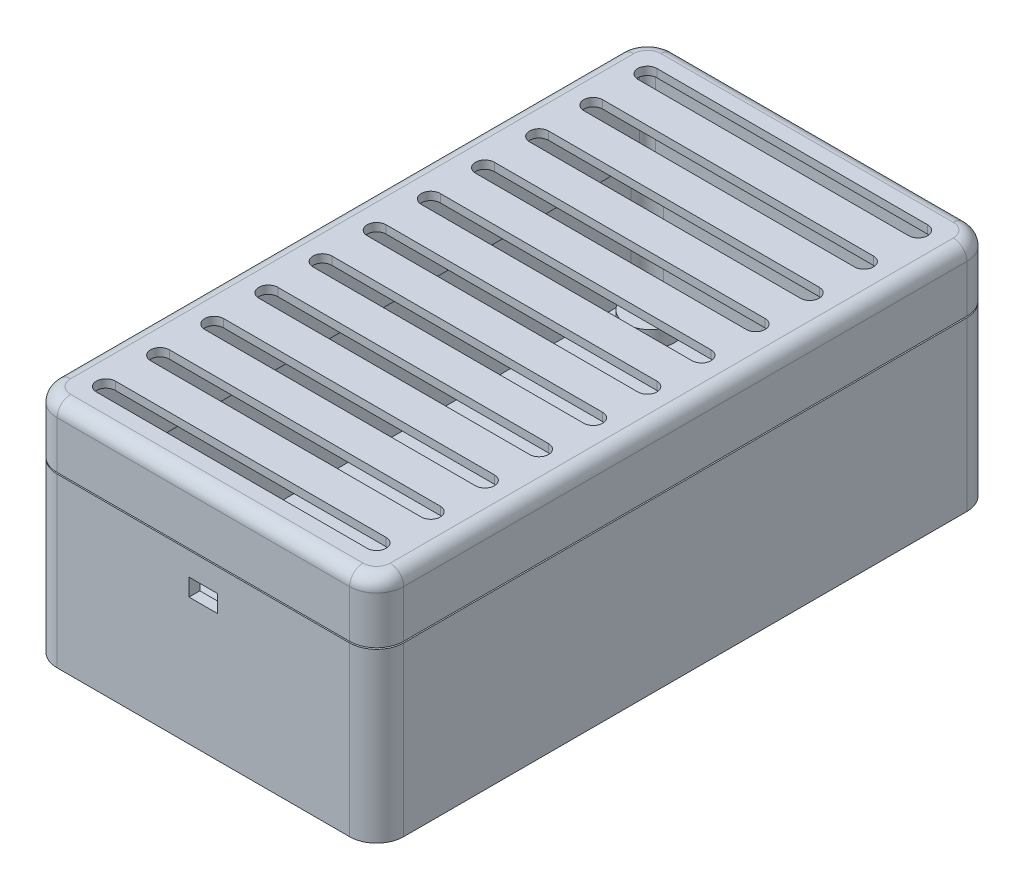
from build123d import *

# Parameters (mm, degrees)
SKETCH1_R                = 2
BOSS_EXTRUDE1_DEPTH      = 3
BOSS_EXTRUDE2_START      = 3
SKETCH1_3_R              = 4.5
SKETCH1_3_R_2            = 2
BOSS_EXTRUDE2_DEPTH      = 3
BOSS_EXTRUDE3_DEPTH      = 28
BOSS_EXTRUDE3_DEPTH_BACK = 3
CHAMFER1_SIZE            = 3.5
CHAMFER1_SIZE2           = 2.020725942
SKETCH3_W                = 10.75
SKETCH3_H                = 6
CUT_EXTRUDE4_DEPTH       = 2.5
SKETCH4_W                = 5.3
SKETCH4_H                = 3.2
CUT_EXTRUDE5_DEPTH       = 2.5
BOSS_EXTRUDE4_DEPTH      = 10
BOSS_EXTRUDE4_DEPTH_BACK = 5
BOSS_EXTRUDE5_START      = -9.75
BOSS_EXTRUDE5_DEPTH      = 9.75
BOSS_EXTRUDE6_DEPTH      = 1.5
FILLET1_R                = 2.5
CUT_EXTRUDE6_DEPTH       = 78.96954541
CUT_EXTRUDE6_DEPTH_BACK  = 78.96954541


with BuildPart() as part:
    # Sketch1 → Boss-Extrude1 (new body)
    with BuildSketch(Plane(origin=(0, 0, 0), x_dir=(1, 0, 0), z_dir=(0, 1, 0))):
        with BuildLine():
            Line((27, 55), (-27, 55))
            ThreePointArc((-27, 55), (-29.121320344, 54.121320344), (-30, 52))
            Line((-30, 52), (-30, -52))
            ThreePointArc((-30, -52), (-29.121320344, -54.121320344), (-27, -55))
            Line((-27, -55), (27, -55))
            ThreePointArc((27, -55), (29.121320344, -54.121320344), (30, -52))
            Line((30, -52), (30, 52))
            ThreePointArc((30, 52), (29.121320344, 54.121320344), (27, 55))
        make_face()
        with Locations(Location((-23.5, 49.05, 0), (0, 0, 270))):
            Circle(SKETCH1_R, mode=Mode.SUBTRACT)
        with Locations(Location((23.5, 49.05, 0), (0, 0, 90))):
            Circle(SKETCH1_R, mode=Mode.SUBTRACT)
        with Locations(Location((23.5, -49.05, 0), (0, 0, 270))):
            Circle(SKETCH1_R, mode=Mode.SUBTRACT)
        with Locations(Location((-23.5, -49.05, 0), (0, 0, 90))):
            Circle(SKETCH1_R, mode=Mode.SUBTRACT)
    extrude(amount=-BOSS_EXTRUDE1_DEPTH)

    # Sketch1<3> → Boss-Extrude2 (add)
    # profile 1 of 4: a face of its own
    with BuildSketch(Plane(origin=(0, 0, 0), x_dir=(1, 0, 0), z_dir=(0, 1, 0)).offset(BOSS_EXTRUDE2_START)):
        with Locations(Location((-23.5, 49.05, 0), (0, 0, 90))):
            Circle(SKETCH1_3_R)
        with Locations(Location((-23.5, 49.05, 0), (0, 0, 270))):
            Circle(SKETCH1_3_R_2, mode=Mode.SUBTRACT)
    # profile 2 of 4: a face of its own
    with BuildSketch(Plane(origin=(0, 0, 0), x_dir=(1, 0, 0), z_dir=(0, 1, 0)).offset(BOSS_EXTRUDE2_START)):
        with Locations(Location((23.5, 49.05, 0), (0, 0, 270))):
            Circle(SKETCH1_3_R)
        with Locations(Location((23.5, 49.05, 0), (0, 0, 270))):
            Circle(SKETCH1_3_R_2, mode=Mode.SUBTRACT)
    # profile 3 of 4: a face of its own
    with BuildSketch(Plane(origin=(0, 0, 0), x_dir=(1, 0, 0), z_dir=(0, 1, 0)).offset(BOSS_EXTRUDE2_START)):
        with Locations(Location((-23.5, -49.05, 0), (0, 0, 90))):
            Circle(SKETCH1_3_R)
        with Locations(Location((-23.5, -49.05, 0), (0, 0, 90))):
            Circle(SKETCH1_3_R_2, mode=Mode.SUBTRACT)
    # profile 4 of 4: a face of its own
    with BuildSketch(Plane(origin=(0, 0, 0), x_dir=(1, 0, 0), z_dir=(0, 1, 0)).offset(BOSS_EXTRUDE2_START)):
        with Locations(Location((23.5, -49.05, 0), (0, 0, 90))):
            Circle(SKETCH1_3_R)
        with Locations(Location((23.5, -49.05, 0), (0, 0, 270))):
            Circle(SKETCH1_3_R_2, mode=Mode.SUBTRACT)
    extrude(amount=-BOSS_EXTRUDE2_DEPTH)

    # Sketch2 → Boss-Extrude3 (add, two sides: drawn at the far end of the back side and taken through both)
    with BuildSketch(Plane(origin=(0, 0, 0), x_dir=(1, 0, 0), z_dir=(0, 1, 0)).offset(-BOSS_EXTRUDE3_DEPTH_BACK)):
        with BuildLine():
            Line((-32, 52), (-32, -52))
            ThreePointArc((-32, -52), (-30.535533906, -55.535533906), (-27, -57))
            Line((-27, -57), (27, -57))
            ThreePointArc((27, -57), (30.535533906, -55.535533906), (32, -52))
            Line((32, -52), (32, 52))
            ThreePointArc((32, 52), (30.535533906, 55.535533906), (27, 57))
            Line((27, 57), (-27, 57))
            ThreePointArc((-27, 57), (-30.535533906, 55.535533906), (-32, 52))
        make_face()
        with BuildLine():
            ThreePointArc((-30, -52), (-29.121320344, -54.121320344), (-27, -55))
            Line((-27, -55), (27, -55))
            ThreePointArc((27, -55), (29.121320344, -54.121320344), (30, -52))
            Line((30, -52), (30, 52))
            ThreePointArc((30, 52), (29.121320344, 54.121320344), (27, 55))
            Line((27, 55), (-27, 55))
            ThreePointArc((-27, 55), (-29.121320344, 54.121320344), (-30, 52))
            Line((-30, 52), (-30, -52))
        make_face(mode=Mode.SUBTRACT)
    extrude(amount=BOSS_EXTRUDE3_DEPTH + BOSS_EXTRUDE3_DEPTH_BACK)

    # Chamfer1
    chamfer1_edges = [part.edges().sort_by_distance(p)[0] for p in [
        (-23.5, -3, -51.05),
        (-23.5, -3, 51.05),
        (23.5, -3, -47.05),
        (23.5, -3, 47.05),
    ]]
    chamfer1_side = [part.faces().sort_by_distance(p)[0] for p in [
        (0, -3, 0),
    ]]
    chamfer(chamfer1_edges, length=CHAMFER1_SIZE, length2=CHAMFER1_SIZE2, reference=chamfer1_side[0])

    # Sketch3 → Cut-Extrude4 (cut, symmetric)
    with BuildSketch(Plane(origin=(0, 0, -57), x_dir=(-1, 0, 0), z_dir=(0, 0, -1))):
        with Locations((1.875, 9)):
            Rectangle(SKETCH3_W, SKETCH3_H)
    extrude(amount=CUT_EXTRUDE4_DEPTH, both=True, mode=Mode.SUBTRACT)

    # Sketch4 → Cut-Extrude5 (cut, symmetric)
    with BuildSketch(Plane.XY.offset(57)):
        with Locations((0, 22.1)):
            Rectangle(SKETCH4_W, SKETCH4_H)
    extrude(amount=CUT_EXTRUDE5_DEPTH, both=True, mode=Mode.SUBTRACT)


with BuildPart() as body_2:
    # Sketch5 → Boss-Extrude4 (new, two sides: drawn at the far end of the back side and taken through both)
    with BuildSketch(Plane(origin=(0, 28, 0), x_dir=(1, 0, 0), z_dir=(0, 1, 0)).offset(-BOSS_EXTRUDE4_DEPTH_BACK)):
        with BuildLine():
            Line((-27, -54.5), (27, -54.5))
            ThreePointArc((27, -54.5), (28.767766953, -53.767766953), (29.5, -52))
            Line((29.5, -52), (29.5, 52))
            ThreePointArc((29.5, 52), (28.767766953, 53.767766953), (27, 54.5))
            Line((27, 54.5), (-27, 54.5))
            ThreePointArc((-27, 54.5), (-28.767766953, 53.767766953), (-29.5, 52))
            Line((-29.5, 52), (-29.5, -52))
            ThreePointArc((-29.5, -52), (-28.767766953, -53.767766953), (-27, -54.5))
        make_face()
        with BuildLine():
            Line((-28.5, 52), (-28.5, -52))
            ThreePointArc((-28.5, -52), (-28.060660172, -53.060660172), (-27, -53.5))
            Line((-27, -53.5), (27, -53.5))
            ThreePointArc((27, -53.5), (28.060660172, -53.060660172), (28.5, -52))
            Line((28.5, -52), (28.5, 52))
            ThreePointArc((28.5, 52), (28.060660172, 53.060660172), (27, 53.5))
            Line((27, 53.5), (-27, 53.5))
            ThreePointArc((-27, 53.5), (-28.060660172, 53.060660172), (-28.5, 52))
        make_face(mode=Mode.SUBTRACT)
    extrude(amount=BOSS_EXTRUDE4_DEPTH + BOSS_EXTRUDE4_DEPTH_BACK)

    # Sketch6 → Boss-Extrude5 (add)
    with BuildSketch(Plane(origin=(0, 38, 0), x_dir=(1, 0, 0), z_dir=(0, 1, 0)).offset(BOSS_EXTRUDE5_START)):
        with BuildLine():
            Line((-32, 52), (-32, -52))
            ThreePointArc((-32, -52), (-30.535533906, -55.535533906), (-27, -57))
            Line((-27, -57), (27, -57))
            ThreePointArc((27, -57), (30.535533906, -55.535533906), (32, -52))
            Line((32, -52), (32, 52))
            ThreePointArc((32, 52), (30.535533906, 55.535533906), (27, 57))
            Line((27, 57), (-27, 57))
            ThreePointArc((-27, 57), (-30.535533906, 55.535533906), (-32, 52))
        make_face()
        with BuildLine():
            Line((-27, -54.5), (27, -54.5))
            ThreePointArc((27, -54.5), (28.767766953, -53.767766953), (29.5, -52))
            Line((29.5, -52), (29.5, 52))
            ThreePointArc((29.5, 52), (28.767766953, 53.767766953), (27, 54.5))
            Line((27, 54.5), (-27, 54.5))
            ThreePointArc((-27, 54.5), (-28.767766953, 53.767766953), (-29.5, 52))
            Line((-29.5, 52), (-29.5, -52))
            ThreePointArc((-29.5, -52), (-28.767766953, -53.767766953), (-27, -54.5))
        make_face(mode=Mode.SUBTRACT)
    extrude(amount=BOSS_EXTRUDE5_DEPTH)

    # Sketch7 → Boss-Extrude6 (add)
    with BuildSketch(Plane(origin=(0, 38, 0), x_dir=(1, 0, 0), z_dir=(0, 1, 0))):
        with BuildLine():
            Line((-32, 52), (-32, -52))
            ThreePointArc((-32, -52), (-30.535533906, -55.535533906), (-27, -57))
            Line((-27, -57), (27, -57))
            ThreePointArc((27, -57), (30.535533906, -55.535533906), (32, -52))
            Line((32, -52), (32, 52))
            ThreePointArc((32, 52), (30.535533906, 55.535533906), (27, 57))
            Line((27, 57), (-27, 57))
            ThreePointArc((-27, 57), (-30.535533906, 55.535533906), (-32, 52))
        make_face()
    extrude(amount=BOSS_EXTRUDE6_DEPTH)

    # Fillet1
    fillet1_edges = [body_2.edges().sort_by_distance(p)[0] for p in [
        (-30.535533906, 39.5, -55.535533906),
        (-32, 39.5, 0),
        (-30.535533906, 39.5, 55.535533906),
        (0, 39.5, 57),
        (30.535533906, 39.5, 55.535533906),
        (32, 39.5, 0),
        (30.535533906, 39.5, -55.535533906),
        (0, 39.5, -57),
    ]]
    fillet(fillet1_edges, radius=FILLET1_R)

    # Sketch8 → Cut-Extrude6 (cut, two sides: drawn at the far end of the back side and taken through both)
    with BuildSketch(Plane(origin=(0, 39.5, 0), x_dir=(1, 0, 0), z_dir=(0, 1, 0)).offset(-CUT_EXTRUDE6_DEPTH_BACK)):
        with BuildLine():
            Line((-25, 51.75), (25, 51.75))
            ThreePointArc((25, 51.75), (26.75, 50), (25, 48.25))
            Line((25, 48.25), (-25, 48.25))
            ThreePointArc((-25, 48.25), (-26.75, 50), (-25, 51.75))
        make_face()
        with BuildLine():
            Line((-25, 41.75), (25, 41.75))
            ThreePointArc((25, 41.75), (26.75, 40), (25, 38.25))
            Line((25, 38.25), (-25, 38.25))
            ThreePointArc((-25, 38.25), (-26.75, 40), (-25, 41.75))
        make_face()
        with BuildLine():
            Line((-25, 31.75), (25, 31.75))
            ThreePointArc((25, 31.75), (26.75, 30), (25, 28.25))
            Line((25, 28.25), (-25, 28.25))
            ThreePointArc((-25, 28.25), (-26.75, 30), (-25, 31.75))
        make_face()
        with BuildLine():
            Line((-25, 21.75), (25, 21.75))
            ThreePointArc((25, 21.75), (26.75, 20), (25, 18.25))
            Line((25, 18.25), (-25, 18.25))
            ThreePointArc((-25, 18.25), (-26.75, 20), (-25, 21.75))
        make_face()
        with BuildLine():
            Line((-25, 11.75), (25, 11.75))
            ThreePointArc((25, 11.75), (26.75, 10), (25, 8.25))
            Line((25, 8.25), (-25, 8.25))
            ThreePointArc((-25, 8.25), (-26.75, 10), (-25, 11.75))
        make_face()
        with BuildLine():
            Line((-25, 1.75), (25, 1.75))
            ThreePointArc((25, 1.75), (26.75, 0), (25, -1.75))
            Line((25, -1.75), (-25, -1.75))
            ThreePointArc((-25, -1.75), (-26.75, 0), (-25, 1.75))
        make_face()
        with BuildLine():
            Line((-25, -8.25), (25, -8.25))
            ThreePointArc((25, -8.25), (26.75, -10), (25, -11.75))
            Line((25, -11.75), (-25, -11.75))
            ThreePointArc((-25, -11.75), (-26.75, -10), (-25, -8.25))
        make_face()
        with BuildLine():
            Line((-25, -18.25), (25, -18.25))
            ThreePointArc((25, -18.25), (26.75, -20), (25, -21.75))
            Line((25, -21.75), (-25, -21.75))
            ThreePointArc((-25, -21.75), (-26.75, -20), (-25, -18.25))
        make_face()
        with BuildLine():
            Line((-25, -28.25), (25, -28.25))
            ThreePointArc((25, -28.25), (26.75, -30), (25, -31.75))
            Line((25, -31.75), (-25, -31.75))
            ThreePointArc((-25, -31.75), (-26.75, -30), (-25, -28.25))
        make_face()
        with BuildLine():
            Line((-25, -38.25), (25, -38.25))
            ThreePointArc((25, -38.25), (26.75, -40), (25, -41.75))
            Line((25, -41.75), (-25, -41.75))
            ThreePointArc((-25, -41.75), (-26.75, -40), (-25, -38.25))
        make_face()
        with BuildLine():
            Line((-25, -48.25), (25, -48.25))
            ThreePointArc((25, -48.25), (26.75, -50), (25, -51.75))
            Line((25, -51.75), (-25, -51.75))
            ThreePointArc((-25, -51.75), (-26.75, -50), (-25, -48.25))
        make_face()
    extrude(amount=CUT_EXTRUDE6_DEPTH + CUT_EXTRUDE6_DEPTH_BACK, mode=Mode.SUBTRACT)


solid = Compound([part.part, body_2.part])
